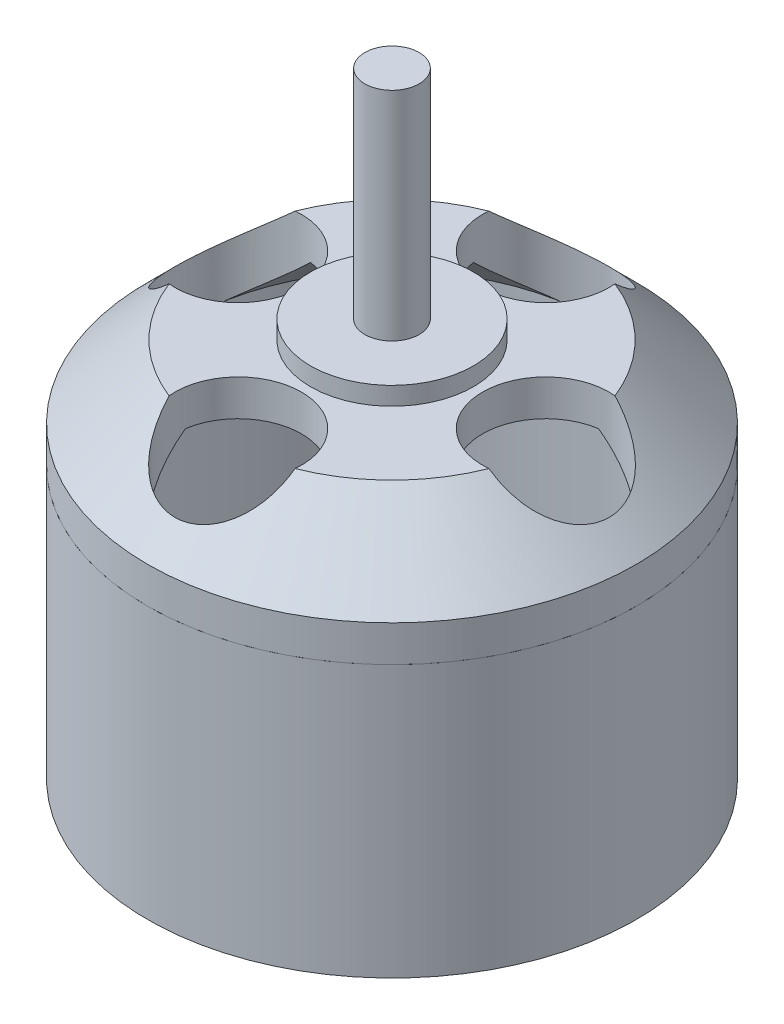
from build123d import *

# Parameters (mm, degrees)
IZIM2_R                          = 13.5
Y_KSEKLIK_EKSTR_ZYON1_DEPTH      = 1
IZIM3_R                          = 13.5
Y_KSEKLIK_EKSTR_ZYON2_DEPTH      = 5
PAH1_SIZE                        = 4
BO_ALTMA1_T                      = -2
IZIM5_R                          = 3.5
KES_EKSTR_ZYON1_DEPTH            = 6
IZIM7_R                          = 4.5
Y_KSEKLIK_EKSTR_ZYON4_DEPTH      = 1
IZIM6_R                          = 13.5
IZIM6_R_2                        = 12.5
Y_KSEKLIK_EKSTR_ZYON6_DEPTH      = 15
Y_KSEKLIK_EKSTR_ZYON7_DEPTH      = 12
Y_KSEKLIK_EKSTR_ZYON7_DEPTH_BACK = 27
IZIM8_R                          = 1.5


with BuildPart() as part:
    # Çizim2 → Yükseklik-Ekstrüzyon1 (new body)
    with BuildSketch(Plane(origin=(0, 0, 0), x_dir=(1, 0, 0), z_dir=(0, 1, 0))):
        with Locations(Location((0, 0, 0), (0, 0, 270))):
            Circle(IZIM2_R)
    extrude(amount=Y_KSEKLIK_EKSTR_ZYON1_DEPTH)

    # Çizim3 → Yükseklik-Ekstrüzyon2 (add)
    with BuildSketch(Plane(origin=(0, 1, 0), x_dir=(1, 0, 0), z_dir=(0, 1, 0))):
        with Locations(Location((0, 0, 0), (0, 0, 270))):
            Circle(IZIM3_R)
    extrude(amount=Y_KSEKLIK_EKSTR_ZYON2_DEPTH)

    # Pah1
    pah1_edges = [part.edges().sort_by_distance(p)[0] for p in [
        (0, 6, -13.5),
    ]]
    chamfer(pah1_edges, length=PAH1_SIZE)

    # İç Boşaltma1
    bo_altma1_openings = [part.faces().sort_by_distance(p)[0] for p in [
        (0, 0, 0),
    ]]
    offset(amount=BO_ALTMA1_T, openings=bo_altma1_openings, kind=Kind.INTERSECTION)

    # Çizim5 → Kes-Ekstrüzyon1 (cut)
    with BuildSketch(Plane(origin=(0, 6, 0), x_dir=(1, 0, 0), z_dir=(0, 1, 0))):
        with Locations(Location((0, -8.5, 0), (0, 0, 306.628480217))):
            Circle(IZIM5_R)
        with Locations(Location((-8.5, 0, 0), (0, 0, 264.454358135))):
            Circle(IZIM5_R)
        with Locations(Location((0, 8.5, 0), (0, 0, 188.996074249))):
            Circle(IZIM5_R)
        with Locations(Location((8.5, 0, 0), (0, 0, 275.545641715))):
            Circle(IZIM5_R)
    extrude(amount=-KES_EKSTR_ZYON1_DEPTH, mode=Mode.SUBTRACT)

    # Çizim7 → Yükseklik-Ekstrüzyon4 (add)
    with BuildSketch(Plane(origin=(0, 6, 0), x_dir=(1, 0, 0), z_dir=(0, 1, 0))):
        with Locations(Location((0, 0, 0), (0, 0, 270))):
            Circle(IZIM7_R)
    extrude(amount=Y_KSEKLIK_EKSTR_ZYON4_DEPTH)


with BuildPart() as body_2:
    # Çizim6 → Yükseklik-Ekstrüzyon6 (new body)
    with BuildSketch(Plane.XZ):
        with Locations(Location((0, 0, 0), (0, 0, 270))):
            Circle(IZIM6_R)
        with Locations(Location((0, 0, 0), (0, 0, 270))):
            Circle(IZIM6_R_2, mode=Mode.SUBTRACT)
    extrude(amount=Y_KSEKLIK_EKSTR_ZYON6_DEPTH)


with BuildPart() as body_3:
    # Çizim8 → Yükseklik-Ekstrüzyon7 (new, two sides: drawn at the far end of the back side and taken through both)
    with BuildSketch(Plane(origin=(0, 7, 0), x_dir=(1, 0, 0), z_dir=(0, 1, 0)).offset(-Y_KSEKLIK_EKSTR_ZYON7_DEPTH_BACK)):
        with Locations(Location((0, 0, 0), (0, 0, 270))):
            Circle(IZIM8_R)
    extrude(amount=Y_KSEKLIK_EKSTR_ZYON7_DEPTH + Y_KSEKLIK_EKSTR_ZYON7_DEPTH_BACK)


solid = Compound([part.part, body_2.part, body_3.part])
